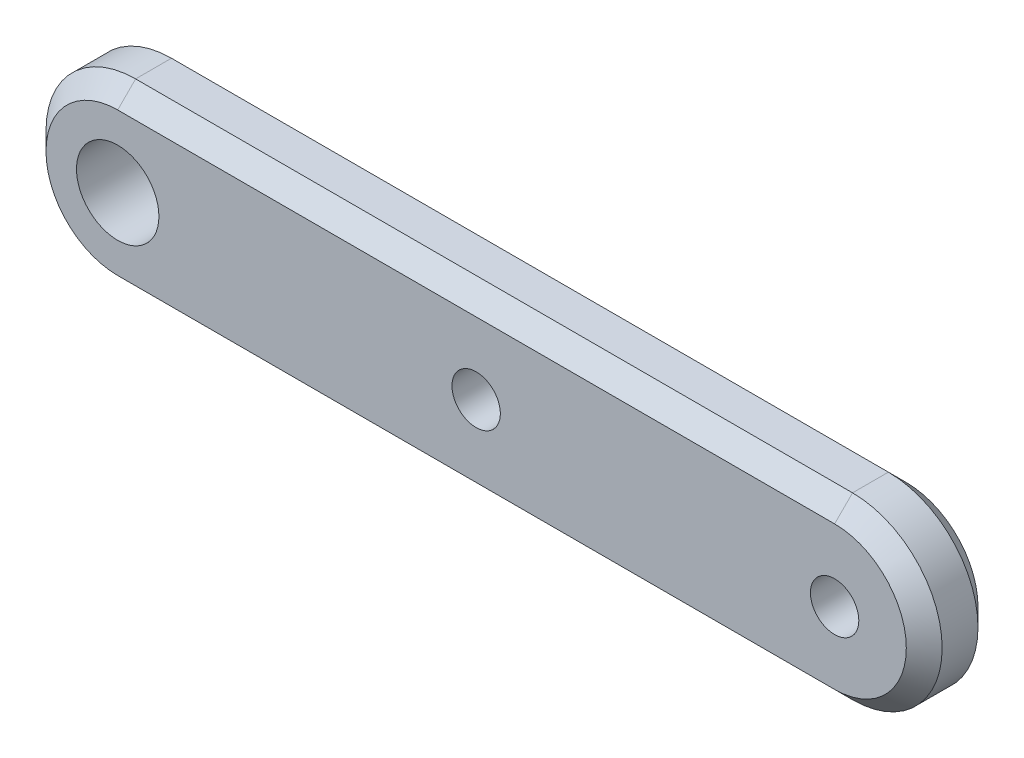
from build123d import *

# Parameters (mm, degrees)
SKETCH1_R           = 1.35
SKETCH1_R_2         = 2.3
BOSS_EXTRUDE1_DEPTH = 4
CHAMFER1_SIZE       = 1


with BuildPart() as part:
    # Sketch1 → Boss-Extrude1 (new body)
    with BuildSketch(Plane.XY):
        with BuildLine():
            Line((40, 5), (0, 5))
            ThreePointArc((0, 5), (-5, 0), (0, -5))
            Line((0, -5), (40, -5))
            ThreePointArc((40, -5), (45, 0), (40, 5))
        make_face()
        with Locations((20, 0)):
            Circle(SKETCH1_R, mode=Mode.SUBTRACT)
        Circle(SKETCH1_R_2, mode=Mode.SUBTRACT)
        with Locations((40, 0)):
            Circle(SKETCH1_R, mode=Mode.SUBTRACT)
    extrude(amount=BOSS_EXTRUDE1_DEPTH)

    # Chamfer1
    chamfer1_edges = [part.edges().sort_by_distance(p)[0] for p in [
        (-5, 0, 0),
        (20, 5, 0),
        (45, 0, 0),
        (20, -5, 0),
        (45, 0, 4),
        (20, 5, 4),
        (-5, 0, 4),
        (20, -5, 4),
    ]]
    chamfer(chamfer1_edges, length=CHAMFER1_SIZE)


solid = part.part
